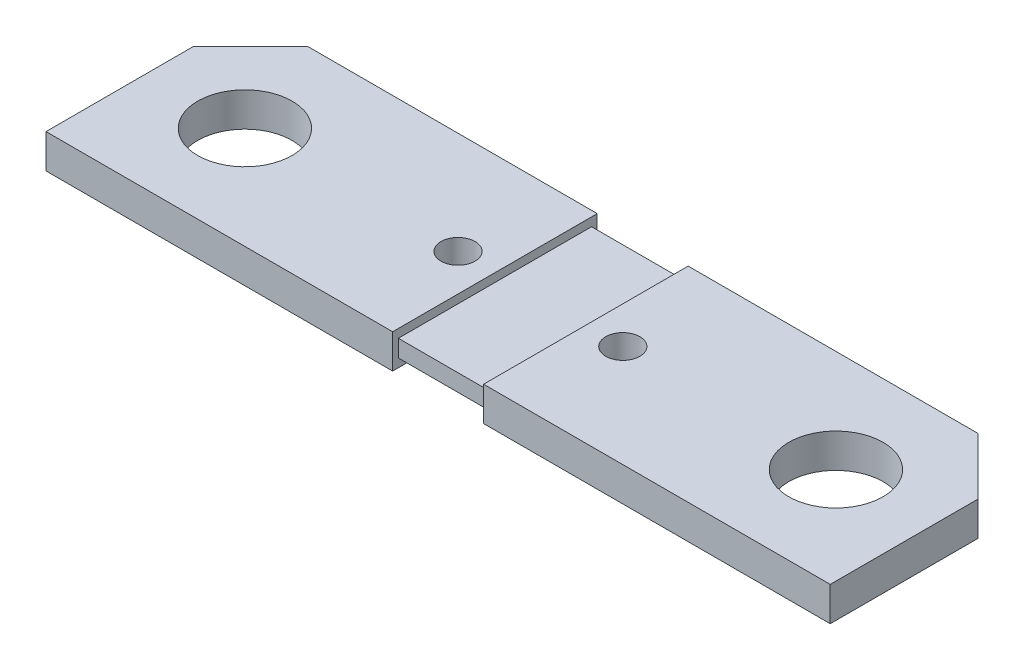
from build123d import *

# Parameters (mm, degrees)
SKETCH1_R             = 4.15
SKETCH1_R_2           = 1.5
BOSS_EXTRUDE1_DEPTH   = 1.5
BOSS_EXTRUDE1_2_DEPTH = 1.5
SKETCH2_W             = 8
SKETCH2_H             = 17
BOSS_EXTRUDE2_DEPTH   = 0.75


with BuildPart() as part:
    # Sketch1 → Boss-Extrude1 (new, symmetric)
    with BuildSketch(Plane(origin=(0, 0, 0), x_dir=(1, 0, 0), z_dir=(0, 1, 0))):
        Polygon((-4, -9), (-34.5, -9), (-34.5, 4), (-29.5, 9), (-4, 9), align=None)
        with Locations(Location((-26, 0, 0), (0, 0, 270))):
            Circle(SKETCH1_R, mode=Mode.SUBTRACT)
        with Locations(Location((-7.25, 0, 0), (0, 0, 270))):
            Circle(SKETCH1_R_2, mode=Mode.SUBTRACT)
    extrude(amount=BOSS_EXTRUDE1_DEPTH, both=True)



with BuildPart() as body_2:
    # Sketch1 → Boss-Extrude1 2 (new, symmetric)
    with BuildSketch(Plane(origin=(0, 0, 0), x_dir=(1, 0, 0), z_dir=(0, 1, 0))):
        Polygon((4, 9), (4, -9), (34.5, -9), (34.5, 4), (29.5, 9), align=None)
        with Locations(Location((7.25, 0, 0), (0, 0, 90))):
            Circle(SKETCH1_R_2, mode=Mode.SUBTRACT)
        with Locations(Location((26, 0, 0), (0, 0, 90))):
            Circle(SKETCH1_R, mode=Mode.SUBTRACT)
    extrude(amount=BOSS_EXTRUDE1_2_DEPTH, both=True)


with BuildPart() as part_1:
    add(part.part)

    add(body_2.part)  # Boss-Extrude2 merges body 2
    # Sketch2 → Boss-Extrude2 (add, symmetric)
    with BuildSketch(Plane(origin=(0, 0, 0), x_dir=(1, 0, 0), z_dir=(0, 1, 0))):
        Rectangle(SKETCH2_W, SKETCH2_H)
    extrude(amount=BOSS_EXTRUDE2_DEPTH, both=True)


solid = part_1.part
